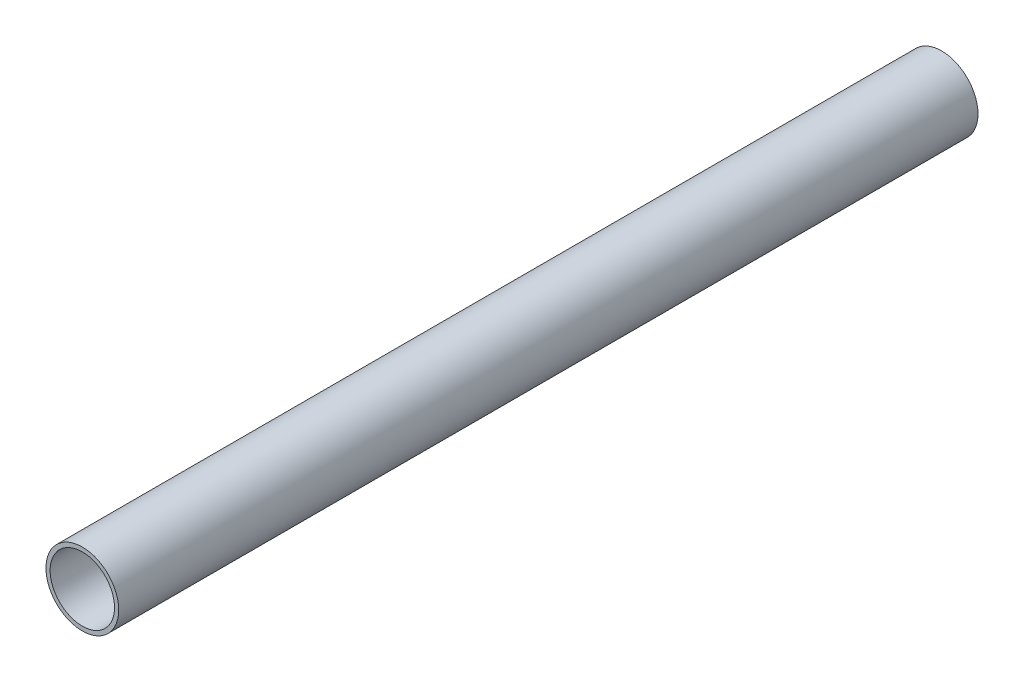
from build123d import *

# Parameters (mm, degrees)
SKETCH1_R          = 25.273
SKETCH1_R_2        = 22.352
BASE_EXTRUDE_DEPTH = 596.9


with BuildPart() as part:
    # Sketch1 → Base-Extrude (new body)
    with BuildSketch(Plane.XY):
        Circle(SKETCH1_R)
        Circle(SKETCH1_R_2, mode=Mode.SUBTRACT)
    extrude(amount=-BASE_EXTRUDE_DEPTH)


solid = part.part
